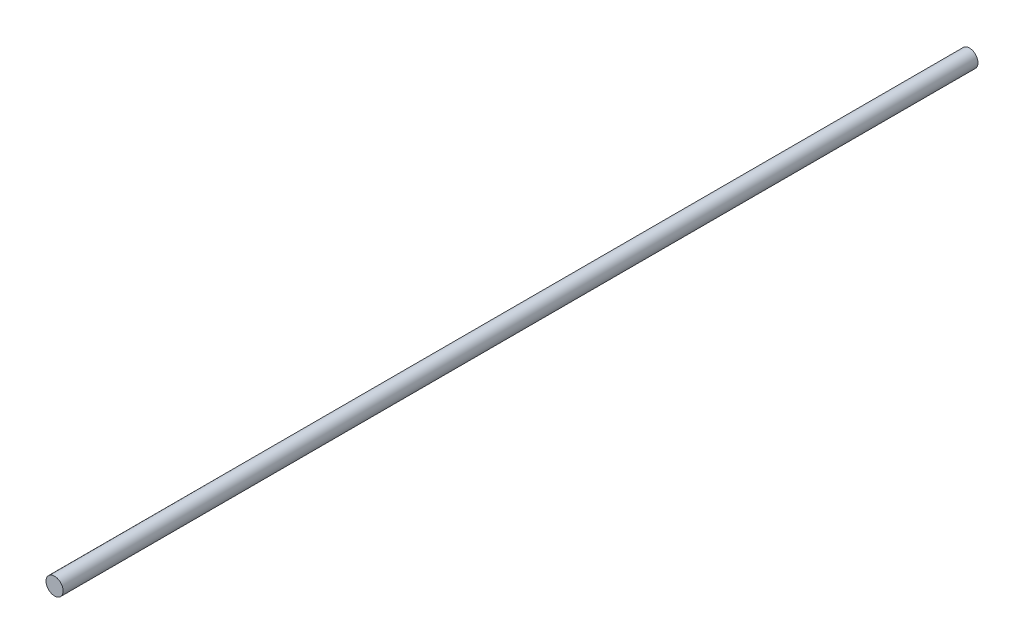
from build123d import *

# Parameters (mm, degrees)
SKETCH_1_R      = 4.7625
EXTRUDE_1_DEPTH = 508


with BuildPart() as part:
    # 草图1 → 凸台-拉伸1 (new body)
    with BuildSketch(Plane.XY):
        Circle(SKETCH_1_R)
    extrude(amount=EXTRUDE_1_DEPTH)


solid = part.part
